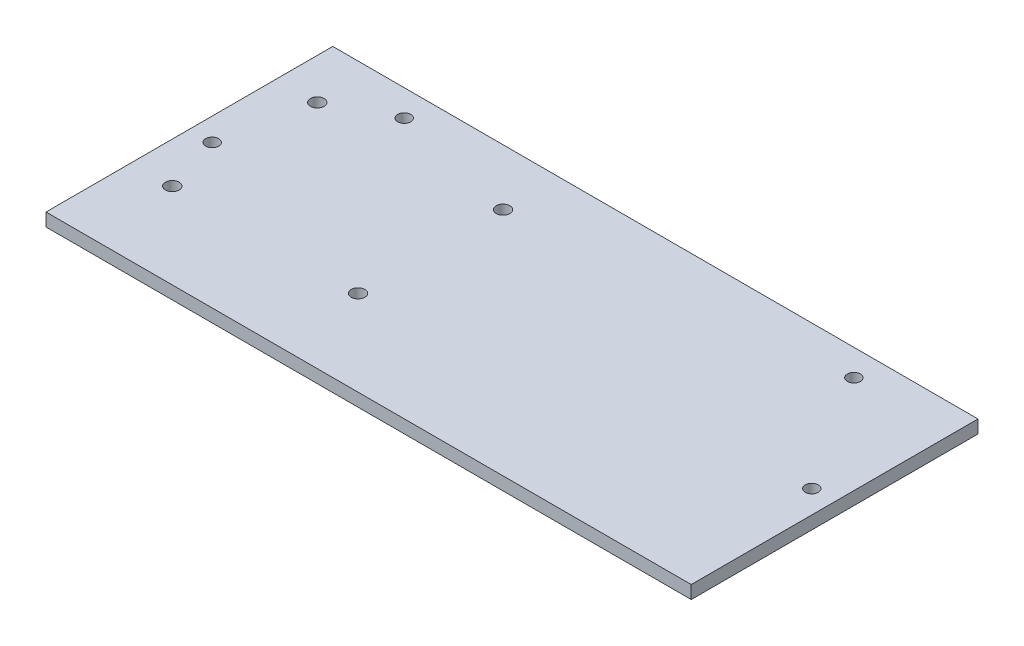
from build123d import *

# Parameters (mm, degrees)
SKETCH1_W           = 198
SKETCH1_H           = 88
BOSS_EXTRUDE1_DEPTH = 4
SKETCH2_R           = 2.1
CUT_EXTRUDE1_DEPTH  = 217.711790173
SKETCH3_R           = 2
CUT_EXTRUDE2_DEPTH  = 10
SKETCH4_R           = 2
CUT_EXTRUDE3_DEPTH  = 25


with BuildPart() as part:
    # Sketch1 → Boss-Extrude1 (new body)
    with BuildSketch(Plane(origin=(0, 0, 0), x_dir=(1, 0, 0), z_dir=(0, 1, 0))):
        with Locations((99, 44)):
            Rectangle(SKETCH1_W, SKETCH1_H)
    extrude(amount=BOSS_EXTRUDE1_DEPTH)

    # Sketch2 → Cut-Extrude1 (cut, through all)
    with BuildSketch(Plane.XZ):
        with Locations(Location((12.5, -26.25, 0), (0, 0, 270))):
            Circle(SKETCH2_R)
        with Locations(Location((69.5, -26.25, 0), (0, 0, 270))):
            Circle(SKETCH2_R)
        with Locations(Location((69.5, -70.75, 0), (0, 0, 270))):
            Circle(SKETCH2_R)
        with Locations(Location((12.5, -70.75, 0), (0, 0, 270))):
            Circle(SKETCH2_R)
    extrude(amount=-CUT_EXTRUDE1_DEPTH, mode=Mode.SUBTRACT)

    # Sketch3 → Cut-Extrude2 (cut)
    with BuildSketch(Plane.XZ):
        with Locations(Location((30, -79.91533843, 0), (0, 0, 270))):
            Circle(SKETCH3_R)
        with Locations(Location((168, -79.91533843, 0), (0, 0, 270))):
            Circle(SKETCH3_R)
    extrude(amount=-CUT_EXTRUDE2_DEPTH, mode=Mode.SUBTRACT)

    # Sketch4 → Cut-Extrude3 (cut)
    with BuildSketch(Plane.XZ):
        with Locations(Location((7, -44, 0), (0, 0, 270))):
            Circle(SKETCH4_R)
        with Locations(Location((191, -44, 0), (0, 0, 270))):
            Circle(SKETCH4_R)
    extrude(amount=-CUT_EXTRUDE3_DEPTH, mode=Mode.SUBTRACT)


solid = part.part
